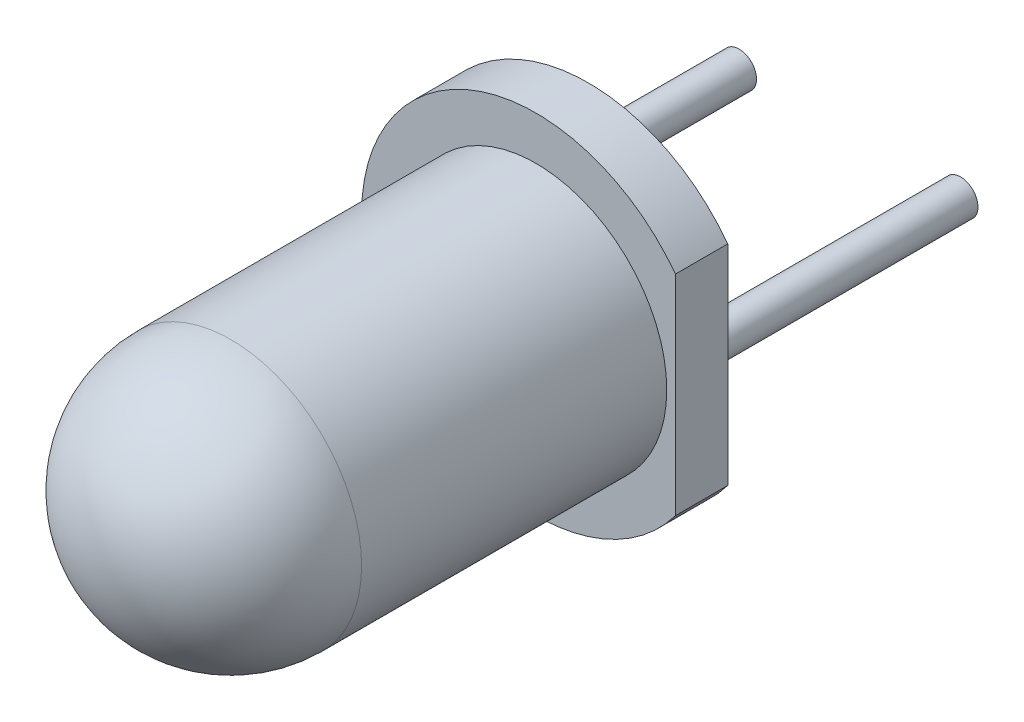
from build123d import *

# Parameters (mm, degrees)
EXTRUDE_1_DEPTH = 0.6
SKETCH_2_R      = 1.5
EXTRUDE_2_DEPTH = 5
FILLET_1_R      = 1.5
SKETCH_3_R      = 0.2
EXTRUDE_3_DEPTH = 3


with BuildPart() as part:
    # 草图1 → 凸台-拉伸1 (new body)
    with BuildSketch(Plane.XY):
        with BuildLine():
            Line((1.6, 1.2), (1.6, -1.2))
            ThreePointArc((1.6, -1.2), (-2, 0), (1.6, 1.2))
        make_face()
    extrude(amount=EXTRUDE_1_DEPTH)

    # 草图2 → 凸台-拉伸2 (add)
    with BuildSketch(Plane.XY.offset(0.6)):
        Circle(SKETCH_2_R)
    extrude(amount=EXTRUDE_2_DEPTH)

    # 圆角1
    fillet_1_edges = [part.edges().sort_by_distance(p)[0] for p in [
        (-1.5, 0, 5.6),
    ]]
    fillet(fillet_1_edges, radius=FILLET_1_R)

    # 草图3 → 凸台-拉伸3 (add)
    with BuildSketch(Plane(origin=(0, 0, 0), x_dir=(-1, 0, 0), z_dir=(0, 0, -1))):
        with Locations(Location((1.27, 0, 0), (0, 0, 180))):
            Circle(SKETCH_3_R)
        with Locations(Location((-1.27, 0, 0), (0, 0, 180))):
            Circle(SKETCH_3_R)
    extrude(amount=EXTRUDE_3_DEPTH)


solid = part.part
